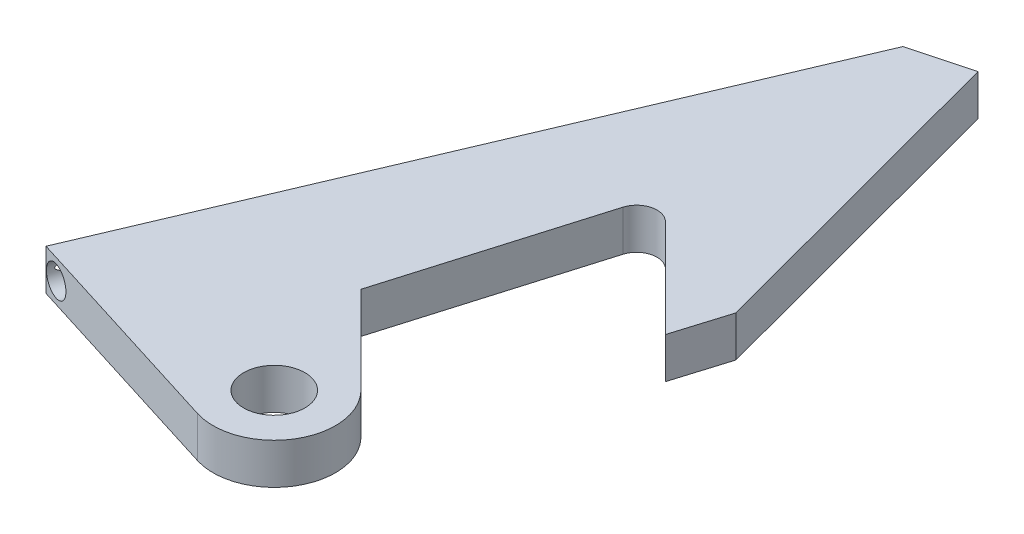
from build123d import *

# Parameters (mm, degrees)
SKETCH1_R                       = 4.7625
BOSS_EXTRUDE1_DEPTH             = 6.35
F_14_0_182_DIAMETER_HOLE1_D     = 4.6228
F_14_0_182_DIAMETER_HOLE1_DEPTH = 2.54
F_14_0_182_DIAMETER_HOLE1_TIP   = 1.388829235


with BuildPart() as part:
    # Sketch1 → Boss-Extrude1 (new body)
    with BuildSketch(Plane(origin=(0, 0, 0), x_dir=(1, 0, 0), z_dir=(0, 1, 0))):
        with BuildLine():
            Line((-2.715472603, -50.452570894), (-16.449210706, -36.716165316))
            Line((-16.449210706, -36.716165316), (-7.143929399, -5.302062091))
            ThreePointArc((-7.143929399, -5.302062091), (-4.881213446, -3.126502672), (-1.85461271, -3.95874678))
            Line((-1.85461271, -3.95874678), (13.315573809, -19.128933299))
            Line((13.315573809, -19.128933299), (15.879471691, -10.753687697))
            Line((15.879471691, -10.753687697), (2.2197595, 40.561165667))
            Line((2.2197595, 40.561165667), (-6.994225827, 38.108456959))
            Line((-6.994225827, 38.108456959), (-46.728023778, -55.399752843))
            Line((-46.728023778, -55.399752843), (-12.38156047, -66.157106701))
            ThreePointArc((-12.38156047, -66.157106701), (-1.47172138, -62.045085351), (-2.715472603, -50.452570894))
        make_face()
        with Locations(Location((-9.583361485, -57.052398719, 0), (0, 0, 270))):
            Circle(SKETCH1_R, mode=Mode.SUBTRACT)
    extrude(amount=BOSS_EXTRUDE1_DEPTH)

    # #14 (0.182) Diameter Hole1
    with Locations(Plane(origin=(-19.975553156, 0, 63.778659005), x_dir=(0.9542892760421928, 0, 0.29888455569143674), z_dir=(-0.29888455569143674, 0, 0.9542892760421928))):
        with Locations((-25.620921468, 3.175)):
            Hole(F_14_0_182_DIAMETER_HOLE1_D / 2, depth=F_14_0_182_DIAMETER_HOLE1_DEPTH)
            with Locations((0, 0, -(F_14_0_182_DIAMETER_HOLE1_DEPTH + F_14_0_182_DIAMETER_HOLE1_TIP / 2))):  # 118° drill point
                Cone(0, F_14_0_182_DIAMETER_HOLE1_D / 2, F_14_0_182_DIAMETER_HOLE1_TIP, mode=Mode.SUBTRACT)


solid = part.part
